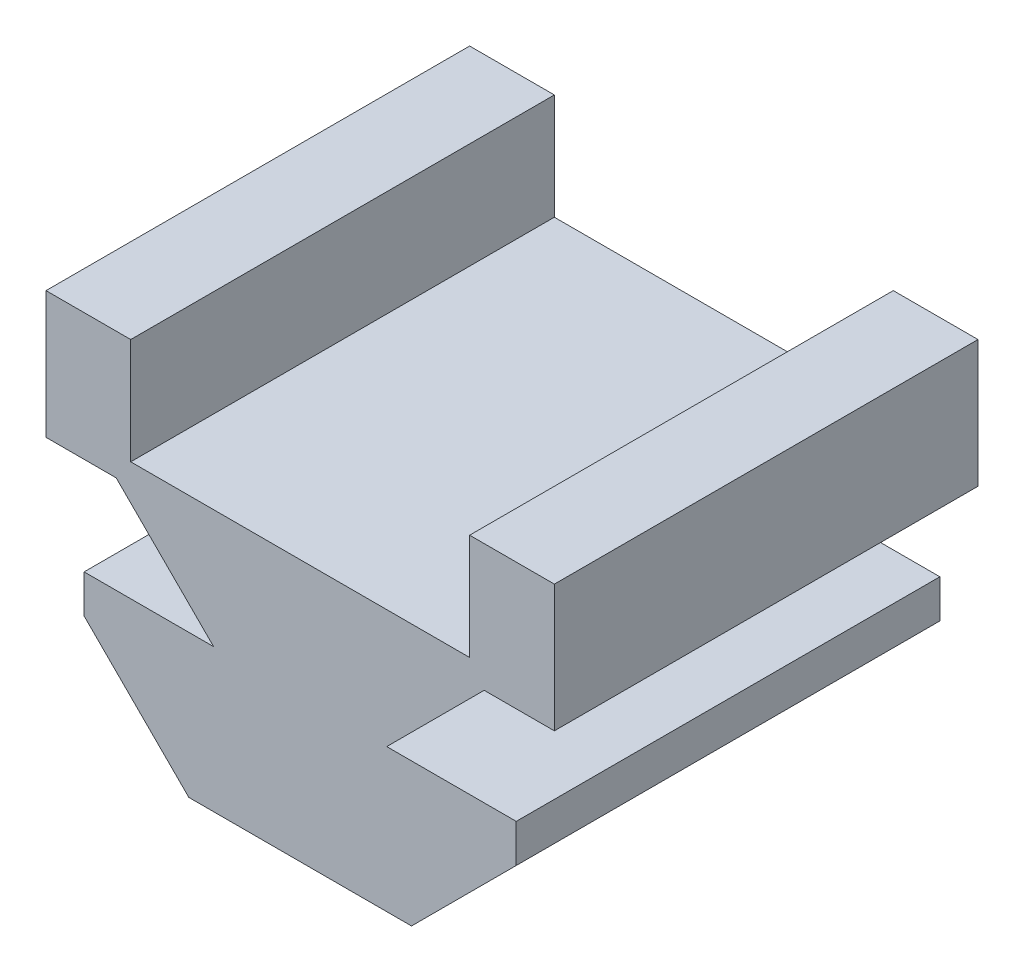
from build123d import *

# Parameters (mm, degrees)
SALIENTE_EXTRUIR1_DEPTH = 10


with BuildPart() as part:
    # Croquis1 → Saliente-Extruir1 (new body)
    with BuildSketch(Plane.XY):
        Polygon((7.372056275, -5.675), (10, -5.675), (10, 0.5), (6, 0.5), (6, 3), (4, 3), (4, 0), (4.4, 0), (4.95, 0), (5.657106781, 0), (7.957106781, -2.3), (4.9, -2.3), (4.9, -3.202943725), align=None)
        Polygon((10, -5.675), (12.627943725, -5.675), (15.1, -3.202943725), (15.1, -2.3), (12.042893219, -2.3), (14.342893219, 0), (16, 0), (16, 3), (14, 3), (14, 0.5), (10, 0.5), align=None)
    extrude(amount=SALIENTE_EXTRUIR1_DEPTH)


solid = part.part
